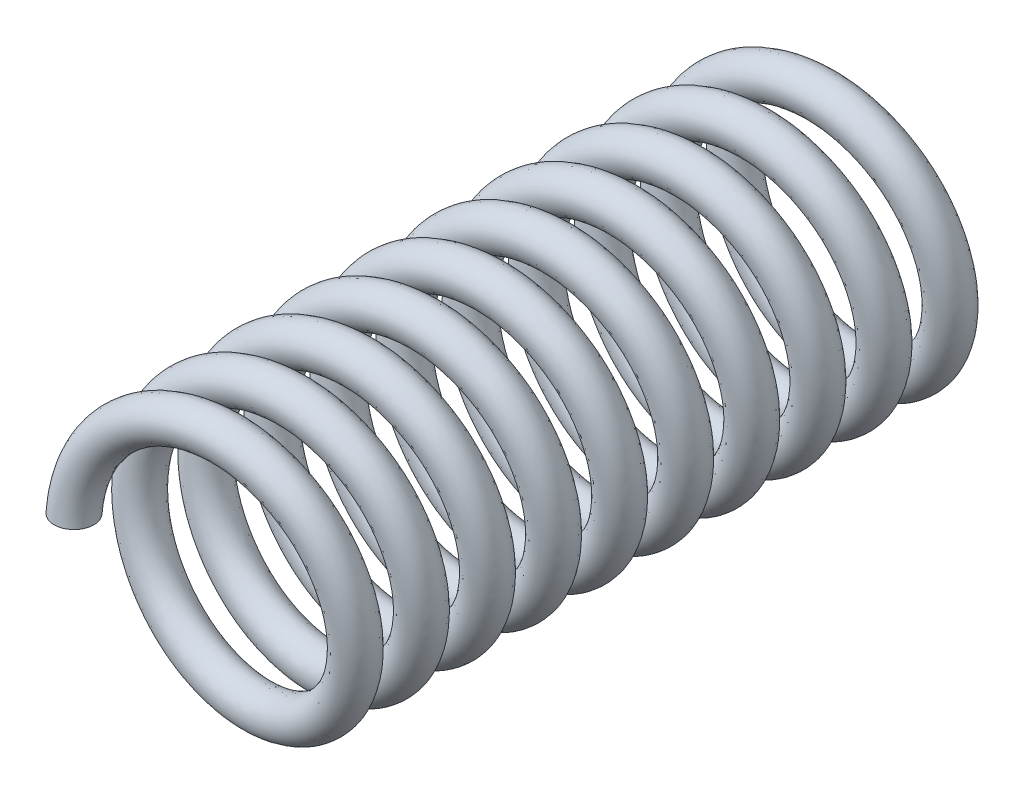
from build123d import *

# Parameters (mm, degrees)
SWEEP1_PITCH       = 2
SWEEP1_HEIGHT      = 20
SWEEP1_RADIUS      = 3.75
SWEEP1_START_ANGLE = -180
SKETCH3_R          = 0.6


with BuildPart() as part:
    # Sweep1: sweep along a helix
    with BuildLine() as sweep1_path:
        add(Helix(SWEEP1_PITCH, SWEEP1_HEIGHT, SWEEP1_RADIUS, center=(0, 0, 0), direction=(0, 0, 1), mode=Mode.PRIVATE).rotate(Axis((0, 0, 0), (0, 0, 1)), SWEEP1_START_ANGLE))
    # Sketch3 → Sweep1 (sweep)
    with BuildSketch(Plane(origin=(0, 0, 0), x_dir=(1, 0, 0), z_dir=(0, 1, 0))):
        with Locations((-3.75, 0)):
            Circle(SKETCH3_R)
    sweep(path=sweep1_path.line, is_frenet=True)


solid = part.part
